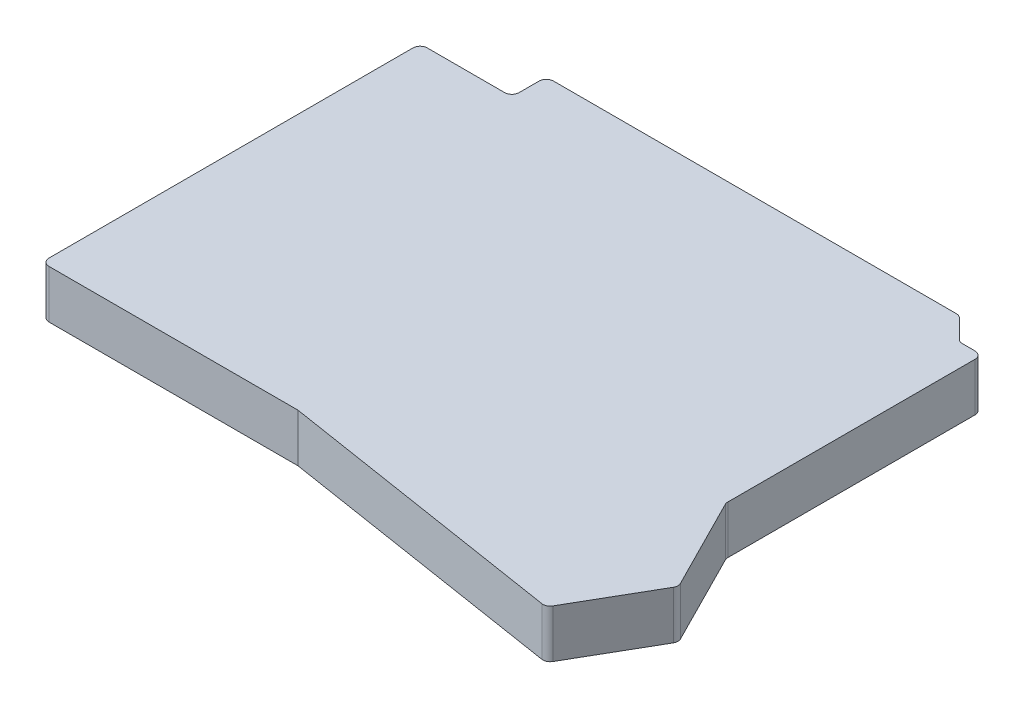
from build123d import *

# Parameters (mm, degrees)
AUFSATZ_LINEAR_AUSTRAGEN1_DEPTH = 10


with BuildPart() as part:
    # Skizze2 → Aufsatz-Linear austragen1 (new body)
    with BuildSketch(Plane(origin=(0, 0, 0), x_dir=(1, 0, 0), z_dir=(0, 1, 0))):
        with BuildLine():
            Line((0, 0), (0, 55.62))
            ThreePointArc((0, 55.62), (0.439339828, 56.680660172), (1.5, 57.12))
            Line((1.5, 57.12), (17.54, 57.12))
            ThreePointArc((17.54, 57.12), (18.600660172, 57.559339828), (19.04, 58.62))
            Line((19.04, 58.62), (19.04, 62.76))
            ThreePointArc((19.04, 62.76), (19.479339828, 63.820660172), (20.54, 64.26))
            Line((20.54, 64.26), (104.098679656, 64.26))
            ThreePointArc((104.098679656, 64.26), (104.672704805, 64.145819299), (105.159339828, 63.820660172))
            Line((105.159339828, 63.820660172), (109.040660172, 59.939339828))
            ThreePointArc((109.040660172, 59.939339828), (109.527295195, 59.614180701), (110.101320344, 59.5))
            Line((110.101320344, 59.5), (112.74, 59.5))
            ThreePointArc((112.74, 59.5), (113.800660172, 59.060660172), (114.24, 58))
            Line((114.24, 58), (114.24, 6.708065653))
            ThreePointArc((114.24, 6.708065653), (114.280993169, 6.359785497), (114.401732089, 6.030541484))
            Line((114.401732089, 6.030541484), (123.948031101, -12.825620738))
            ThreePointArc((123.948031101, -12.825620738), (124.109197107, -13.544350864), (123.908801296, -14.253144906))
            Line((123.908801296, -14.253144906), (114.755057795, -30.10789373))
            ThreePointArc((114.755057795, -30.10789373), (114.102280417, -30.71153588), (113.222449486, -30.839597128))
            Line((113.222449486, -30.839597128), (53.266068474, -21.388296602))
            ThreePointArc((53.266068474, -21.388296602), (53.149641138, -21.374581146), (53.032498271, -21.37))
            Line((53.032498271, -21.37), (1.5, -21.37))
            ThreePointArc((1.5, -21.37), (0.439339828, -20.930660172), (0, -19.87))
            Line((0, -19.87), (0, 0))
        make_face()
    extrude(amount=AUFSATZ_LINEAR_AUSTRAGEN1_DEPTH)


solid = part.part
